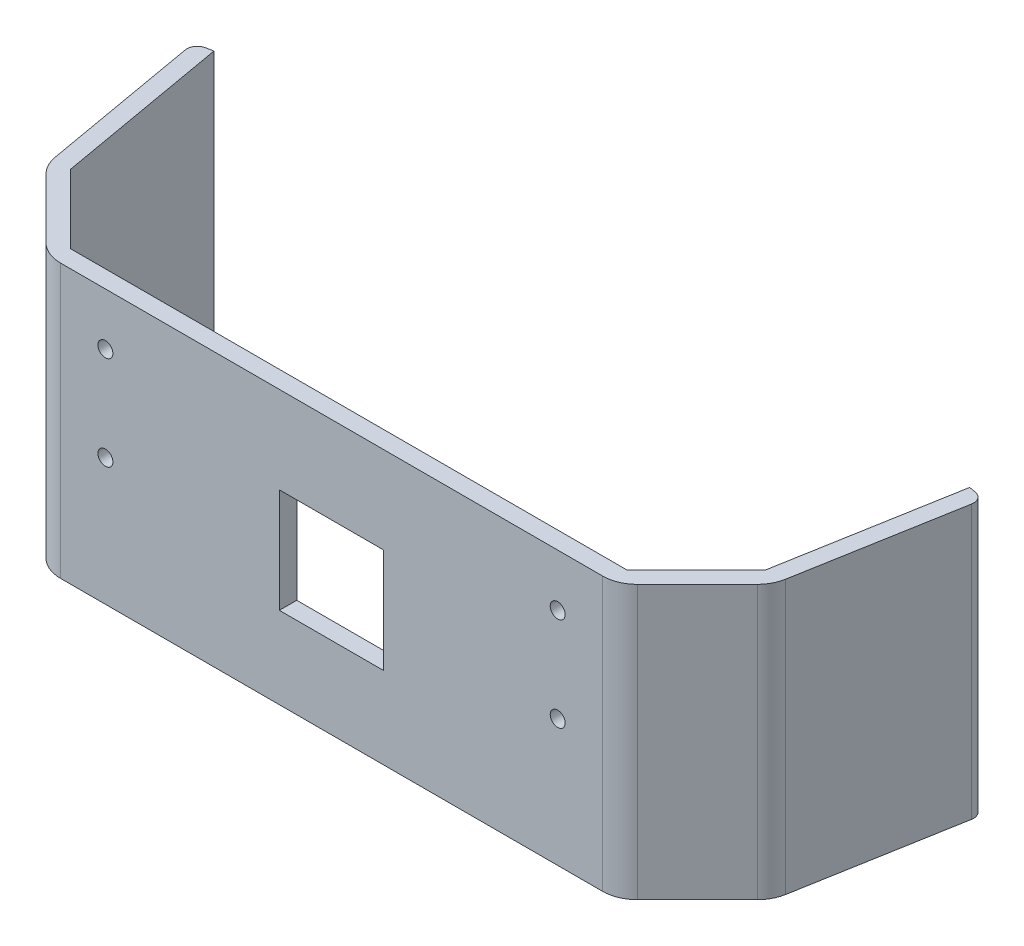
from build123d import *

# Parameters (mm, degrees)
BOSS_EXTRUDE1_DEPTH = 78.5
FILLET1_R           = 10
FILLET2_R           = 10
FILLET12_R          = 10
FILLET13_R          = 3
SKETCH2_W           = 30
SKETCH2_H           = 30
CUT_EXTRUDE1_DEPTH  = 78.5
SKETCH4_R           = 2.15
CUT_EXTRUDE2_DEPTH  = 78.5


with BuildPart() as part:
    # Sketch1 → Boss-Extrude1 (new body)
    with BuildSketch(Plane(origin=(0, 0, 0), x_dir=(1, 0, 0), z_dir=(0, 1, 0))):
        Polygon((-80, 0), (80, 0), (99.798989873, 19.798989873), (108.615338909, 69.798989873), (113.539377674, 68.930748985), (104.449273338, 17.378205526), (82.071067812, -5), (-82.071067812, -5), (-104.449273338, 17.378205526), (-113.539377674, 68.930748985), (-108.615338909, 69.798989873), (-99.798989873, 19.798989873), align=None)
    extrude(amount=BOSS_EXTRUDE1_DEPTH)

    # Fillet1
    fillet1_edges = [part.edges().sort_by_distance(p)[0] for p in [
        (82.071067812, 39.25, 5),
    ]]
    fillet(fillet1_edges, radius=FILLET1_R)

    # Fillet2
    fillet2_edges = [part.edges().sort_by_distance(p)[0] for p in [
        (104.449273338, 39.25, -17.378205526),
    ]]
    fillet(fillet2_edges, radius=FILLET2_R)

    # Fillet12
    fillet12_edges = [part.edges().sort_by_distance(p)[0] for p in [
        (-104.449273338, 39.25, -17.378205526),
        (-82.071067812, 39.25, 5),
    ]]
    fillet(fillet12_edges, radius=FILLET12_R)

    # Fillet13
    fillet13_edges = [part.edges().sort_by_distance(p)[0] for p in [
        (-113.539377674, 39.25, -68.930748985),
        (113.539377674, 39.25, -68.930748985),
    ]]
    fillet(fillet13_edges, radius=FILLET13_R)

    # Sketch2 → Cut-Extrude1 (cut)
    with BuildSketch(Plane.XY.offset(5)):
        with Locations((0, 38.5)):
            Rectangle(SKETCH2_W, SKETCH2_H)
    extrude(amount=-CUT_EXTRUDE1_DEPTH, mode=Mode.SUBTRACT)

    # Sketch4 → Cut-Extrude2 (cut)
    with BuildSketch(Plane.XY.offset(5)):
        with Locations((65, 36.5)):
            Circle(SKETCH4_R)
        with Locations((65, 63.5)):
            Circle(SKETCH4_R)
        with Locations((-65, 63.5)):
            Circle(SKETCH4_R)
        with Locations((-65, 36.5)):
            Circle(SKETCH4_R)
    extrude(amount=-CUT_EXTRUDE2_DEPTH, mode=Mode.SUBTRACT)


solid = part.part
